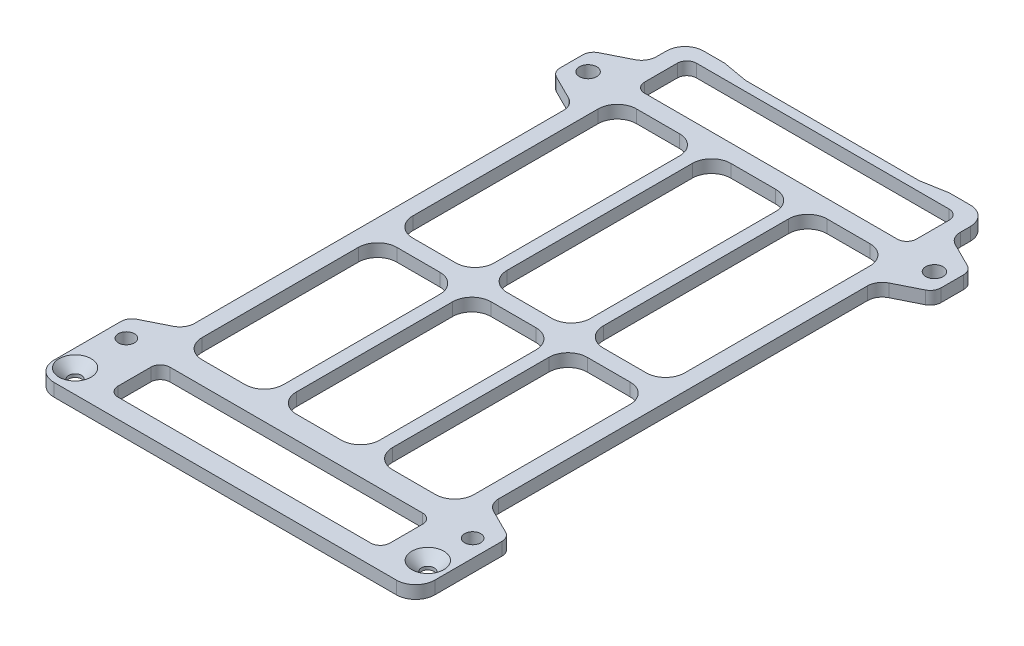
from build123d import *

# Parameters (mm, degrees)
SKETCH_1_R          = 1.35
SKETCH_1_R_2        = 1
SKETCH_1_R_3        = 1.25
EXTRUDE_1_DEPTH     = 2
FILLET_1_R          = 3
SKETCH_3_W          = 12.7
SKETCH_3_H          = 30.365325547
SKETCH_3_W_2        = 13
SKETCH_3_H_2        = 34.884674453
SKETCH_3_W_3        = 42.4
SKETCH_3_H_3        = 8.100647313
SKETCH_3_H_4        = 8.099352903
CUT_EXTRUDE_1_DEPTH = 60.74330897
FILLET_2_R          = 3
FILLET_3_R          = 1.5
CHAMFER_1_SIZE      = 1.5


with BuildPart() as part:
    # 草图1 → 凸台-拉伸1 (new body)
    with BuildSketch(Plane(origin=(0, 0, 0), x_dir=(1, 0, 0), z_dir=(0, 1, 0))):
        with BuildLine():
            Line((-29.7, -30.13671529), (-29.7, -43.600647313))
            Line((-29.7, -43.600647313), (29.7, -43.600647313))
            Line((29.7, -43.600647313), (29.7, -30.13671529))
            ThreePointArc((29.7, -30.13671529), (29.446106374, -29.2429724), (28.760263112, -28.616189066))
            Line((28.760263112, -28.616189066), (24.97140873, -26.721761875))
            ThreePointArc((24.97140873, -26.721761875), (24.043503141, -25.873760893), (23.7, -24.664579335))
            Line((23.7, -24.664579335), (23.7, 32.86328471))
            ThreePointArc((23.7, 32.86328471), (24.043503141, 34.072466267), (24.97140873, 34.920467249))
            Line((24.97140873, 34.920467249), (28.760263112, 36.81489444))
            ThreePointArc((28.760263112, 36.81489444), (29.446106374, 37.441677774), (29.7, 38.335420665))
            Line((29.7, 38.335420665), (29.7, 41.863284896))
            ThreePointArc((29.7, 41.863284896), (29.446106374, 42.757027787), (28.760263112, 43.383811121))
            Line((28.760263112, 43.383811121), (24.971408673, 45.278238341))
            ThreePointArc((24.971408673, 45.278238341), (24.043503084, 46.126239322), (23.699999943, 47.33542088))
            Line((23.699999943, 47.33542088), (23.699999943, 48.899352903))
            ThreePointArc((23.699999943, 48.899352903), (22.850609608, 50.949962568), (20.799999943, 51.799352902))
            Line((20.799999943, 51.799352902), (17.526051986, 51.799352902))
            Line((17.526051986, 51.799352902), (13.526051986, 51.099352903))
            Line((13.526051986, 51.099352903), (-13.5260521, 51.099352903))
            Line((-13.5260521, 51.099352903), (-17.5260521, 51.799352903))
            Line((-17.5260521, 51.799352903), (-20.800000057, 51.799352903))
            ThreePointArc((-20.800000057, 51.799352903), (-22.850609723, 50.949962568), (-23.700000057, 48.899352903))
            Line((-23.700000057, 48.899352903), (-23.700000057, 47.33542088))
            ThreePointArc((-23.700000057, 47.33542088), (-24.043503184, 46.126239345), (-24.97140874, 45.278238364))
            Line((-24.97140874, 45.278238364), (-28.760263161, 43.383811045))
            ThreePointArc((-28.760263161, 43.383811045), (-29.446106456, 42.757027659), (-29.700000093, 41.86328471))
            Line((-29.700000093, 41.86328471), (-29.700000093, 38.335420665))
            ThreePointArc((-29.700000093, 38.335420665), (-29.446106448, 37.44167771), (-28.760263093, 36.814894415))
            Line((-28.760263093, 36.814894415), (-24.971408738, 34.920467256))
            ThreePointArc((-24.971408738, 34.920467256), (-24.043503143, 34.072466274), (-23.7, 32.863284713))
            Line((-23.7, 32.863284713), (-23.7, -24.664579335))
            ThreePointArc((-23.7, -24.664579335), (-24.043503141, -25.873760893), (-24.97140873, -26.721761875))
            Line((-24.97140873, -26.721761875), (-28.760263112, -28.616189066))
            ThreePointArc((-28.760263112, -28.616189066), (-29.446106374, -29.2429724), (-29.7, -30.13671529))
        make_face()
        with Locations(Location((-27, 40, 0), (0, 0, 270))):
            Circle(SKETCH_1_R, mode=Mode.SUBTRACT)
        with Locations(Location((27, 40, 0), (0, 0, 270))):
            Circle(SKETCH_1_R, mode=Mode.SUBTRACT)
        with Locations(Location((-27, -40, 0), (0, 0, 270))):
            Circle(SKETCH_1_R_2, mode=Mode.SUBTRACT)
        with Locations(Location((26.5, -38.5, 0), (0, 0, 270))):
            Circle(SKETCH_1_R_2, mode=Mode.SUBTRACT)
        with Locations(Location((-27, -32, 0), (0, 0, 270))):
            Circle(SKETCH_1_R_3, mode=Mode.SUBTRACT)
        with Locations(Location((27, -32, 0), (0, 0, 270))):
            Circle(SKETCH_1_R_3, mode=Mode.SUBTRACT)
    extrude(amount=EXTRUDE_1_DEPTH)

    # 圆角1
    fillet_1_edges = [part.edges().sort_by_distance(p)[0] for p in [
        (29.7, 1, 43.600647313),
        (-29.7, 1, 43.600647313),
    ]]
    fillet(fillet_1_edges, radius=FILLET_1_R)

    # 草图3 → 切除-拉伸1 (cut, through all)
    with BuildSketch(Plane(origin=(0, 2, 0), x_dir=(1, 0, 0), z_dir=(0, 1, 0))):
        with Locations((14.85, -13.817337227)):
            Rectangle(SKETCH_3_W, SKETCH_3_H)
        with Locations((0, -13.817337227)):
            Rectangle(SKETCH_3_W_2, SKETCH_3_H)
        with Locations((-14.85, 21.307662773)):
            Rectangle(SKETCH_3_W, SKETCH_3_H_2)
        with Locations((0, 21.307662773)):
            Rectangle(SKETCH_3_W_2, SKETCH_3_H_2)
        with Locations((-14.85, -13.817337227)):
            Rectangle(SKETCH_3_W, SKETCH_3_H)
        with Locations((14.85, 21.307662773)):
            Rectangle(SKETCH_3_W, SKETCH_3_H_2)
        with Locations((0, -36.550323656)):
            Rectangle(SKETCH_3_W_3, SKETCH_3_H_3)
        with Locations((0, 45.549676452)):
            Rectangle(SKETCH_3_W_3, SKETCH_3_H_4)
    extrude(amount=-CUT_EXTRUDE_1_DEPTH, mode=Mode.SUBTRACT)

    # 圆角2
    fillet_2_edges = [part.edges().sort_by_distance(p)[0] for p in [
        (21.2, 1, -1.365325547),
        (21.2, 1, 29),
        (8.5, 1, 29),
        (8.5, 1, -1.365325547),
        (-21.2, 1, 29),
        (-21.2, 1, -1.365325547),
        (-8.5, 1, -1.365325547),
        (-8.5, 1, 29),
        (-6.5, 1, 29),
        (-6.5, 1, -1.365325547),
        (6.5, 1, -1.365325547),
        (6.5, 1, 29),
        (-6.5, 1, -3.865325547),
        (-6.5, 1, -38.75),
        (6.5, 1, -38.75),
        (6.5, 1, -3.865325547),
        (21.2, 1, -38.75),
        (21.2, 1, -3.865325547),
        (8.5, 1, -3.865325547),
        (8.5, 1, -38.75),
        (-21.2, 1, -3.865325547),
        (-21.2, 1, -38.75),
        (-8.5, 1, -38.75),
        (-8.5, 1, -3.865325547),
    ]]
    fillet(fillet_2_edges, radius=FILLET_2_R)

    # 圆角3
    fillet_3_edges = [part.edges().sort_by_distance(p)[0] for p in [
        (-21.2, 1, 40.600647313),
        (-21.2, 1, 32.5),
        (21.2, 1, 32.5),
        (21.2, 1, 40.600647313),
        (-21.2, 1, -41.5),
        (-21.2, 1, -49.599352903),
        (21.2, 1, -49.599352903),
        (21.2, 1, -41.5),
    ]]
    fillet(fillet_3_edges, radius=FILLET_3_R)

    # 倒角1
    chamfer_1_edges = [part.edges().sort_by_distance(p)[0] for p in [
        (-27, 2, 39),
        (26.5, 2, 37.5),
    ]]
    chamfer(chamfer_1_edges, length=CHAMFER_1_SIZE)


solid = part.part
